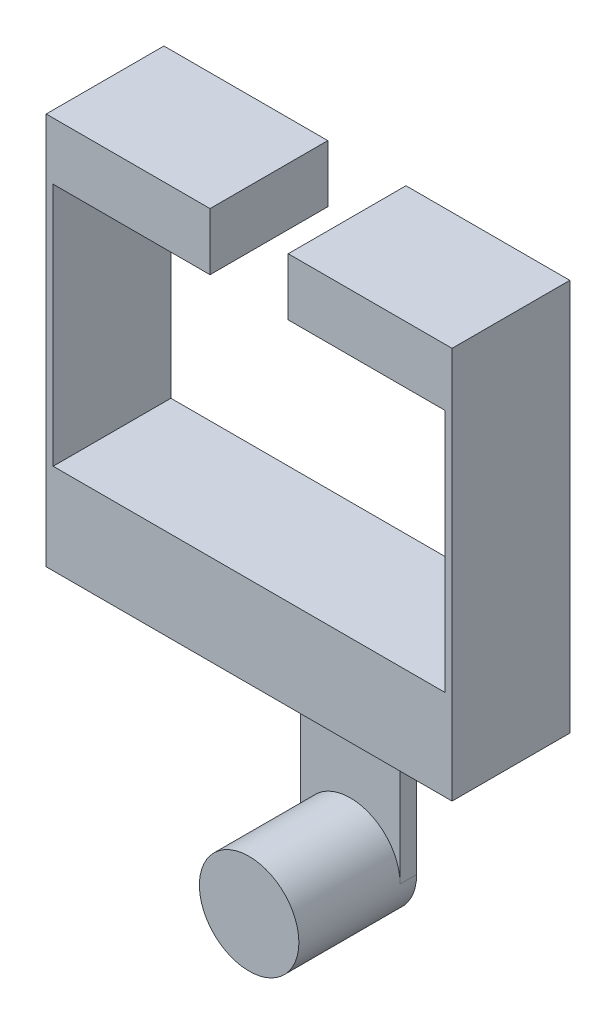
from build123d import *

# Parameters (mm, degrees)
SKETCH2_R           = 8.049775325
BOSS_EXTRUDE1_DEPTH = 19.05
SKETCH3_W           = 16.09955065
SKETCH3_H           = 32.199101299
BOSS_EXTRUDE2_DEPTH = 2.671544542
SKETCH4_W           = 63.40856
SKETCH4_H           = 19.05
BOSS_EXTRUDE3_DEPTH = 14.654134452
SKETCH5_W           = 19.05
SKETCH5_H           = 54.17415065
BOSS_EXTRUDE4_DEPTH = 1.128888889
SKETCH6_W           = 26.508568889
SKETCH6_H           = 19.05
BOSS_EXTRUDE5_DEPTH = 9.271057991


with BuildPart() as part:
    # Sketch2 → Boss-Extrude1 (new body)
    with BuildSketch(Plane.XY):
        with Locations(Location((0, 0, 0), (0, 0, 180))):
            Circle(SKETCH2_R)
    extrude(amount=BOSS_EXTRUDE1_DEPTH)

    # Sketch3 → Boss-Extrude2 (add)
    with BuildSketch(Plane(origin=(0, 0, 0), x_dir=(-1, 0, 0), z_dir=(0, 0, -1))):
        with Locations((0, 16.099550649)):
            Rectangle(SKETCH3_W, SKETCH3_H)
    extrude(amount=-BOSS_EXTRUDE2_DEPTH)

    # Sketch4 → Boss-Extrude3 (add)
    with BuildSketch(Plane(origin=(0, 32.199101299, 0), x_dir=(1, 0, 0), z_dir=(0, 1, 0))):
        with Locations((0, -9.525)):
            Rectangle(SKETCH4_W, SKETCH4_H)
    extrude(amount=BOSS_EXTRUDE3_DEPTH)

    # Sketch5 → Boss-Extrude4 (add)
    with BuildSketch(Plane(origin=(31.70428, 0, 0), x_dir=(0, 0, -1), z_dir=(1, 0, 0))):
        with Locations((-9.525, 59.286176624)):
            Rectangle(SKETCH5_W, SKETCH5_H)
    boss_extrude4 = extrude(amount=BOSS_EXTRUDE4_DEPTH)

    # Mirror1: Boss-Extrude4 across plane
    add(boss_extrude4.mirror(Plane(origin=(0, 0, 0), x_dir=(0, 0, 1), z_dir=(1, 0, 0))))

    # Sketch6 → Boss-Extrude5 (add)
    with BuildSketch(Plane(origin=(0, 86.373251949, 0), x_dir=(1, 0, 0), z_dir=(0, 1, 0))):
        with Locations((19.578884444, -9.525)):
            Rectangle(SKETCH6_W, SKETCH6_H)
    boss_extrude5 = extrude(amount=BOSS_EXTRUDE5_DEPTH)

    # Mirror2: Boss-Extrude4, Boss-Extrude5 across plane
    add(boss_extrude4.mirror(Plane(origin=(0, 0, 0), x_dir=(0, 0, 1), z_dir=(1, 0, 0))))
    add(boss_extrude5.mirror(Plane(origin=(0, 0, 0), x_dir=(0, 0, 1), z_dir=(1, 0, 0))))


solid = part.part
